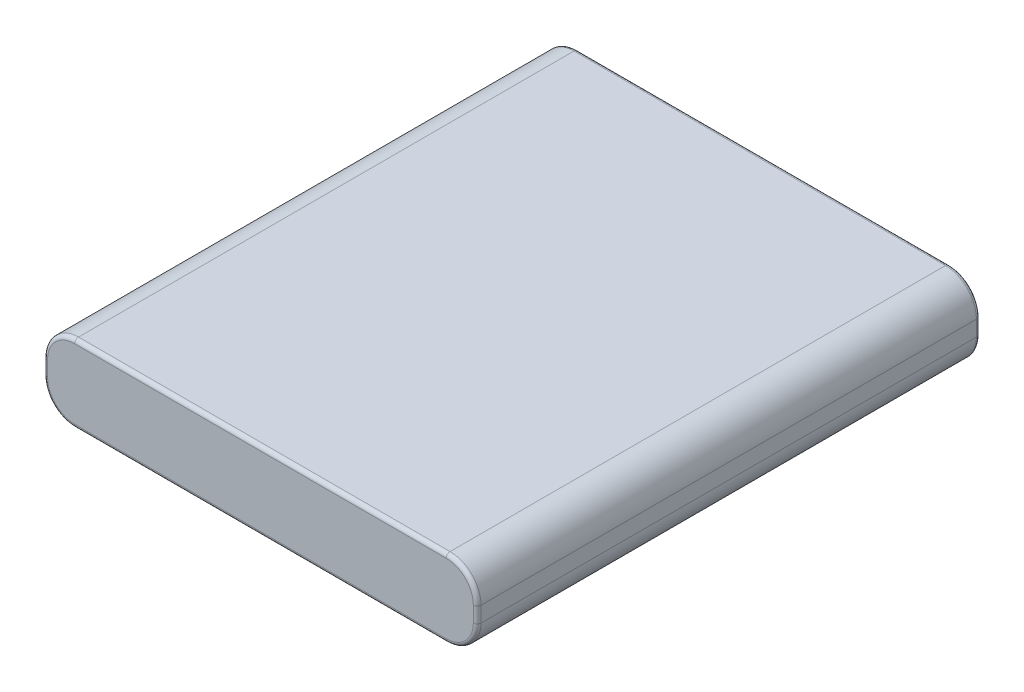
from build123d import *

# Parameters (mm, degrees)
SKETCH_1_W      = 56
SKETCH_1_H      = 65
EXTRUDE_1_DEPTH = 10
FILLET_1_R      = 4
FILLET_2_R      = 0.5
SKETCH_2_R      = 7
EXTRUDE_2_DEPTH = 2


with BuildPart() as part:
    # 草图1 → 凸台-拉伸1 (new body)
    with BuildSketch(Plane(origin=(0, 0, 0), x_dir=(1, 0, 0), z_dir=(0, 1, 0))):
        Rectangle(SKETCH_1_W, SKETCH_1_H)
    extrude(amount=EXTRUDE_1_DEPTH)

    # 圆角1
    fillet_1_edges = [part.edges().sort_by_distance(p)[0] for p in [
        (-28, 10, 0),
        (28, 10, 0),
        (-28, 0, 0),
        (28, 0, 0),
    ]]
    fillet(fillet_1_edges, radius=FILLET_1_R)

    # 圆角2
    fillet_2_edges = [part.edges().sort_by_distance(p)[0] for p in [
        (-28, 5, 32.5),
        (-28, 5, -32.5),
        (0, 0, 32.5),
        (28, 5, 32.5),
        (0, 10, 32.5),
        (-26.828427125, 8.828427125, 32.5),
        (26.828427125, 8.828427125, 32.5),
        (26.828427125, 1.171572875, 32.5),
        (-26.828427125, 1.171572875, 32.5),
        (0, 0, -32.5),
        (0, 10, -32.5),
        (28, 5, -32.5),
        (-26.828427125, 8.828427125, -32.5),
        (26.828427125, 8.828427125, -32.5),
        (26.828427125, 1.171572875, -32.5),
        (-26.828427125, 1.171572875, -32.5),
    ]]
    fillet(fillet_2_edges, radius=FILLET_2_R)

    # 草图2 → 凸台-拉伸2 (add)
    with BuildSketch(Plane.XZ):
        with Locations(Location((0, 6.105786748, 0), (0, 0, 90))):
            Circle(SKETCH_2_R)
    extrude(amount=EXTRUDE_2_DEPTH)


solid = part.part
